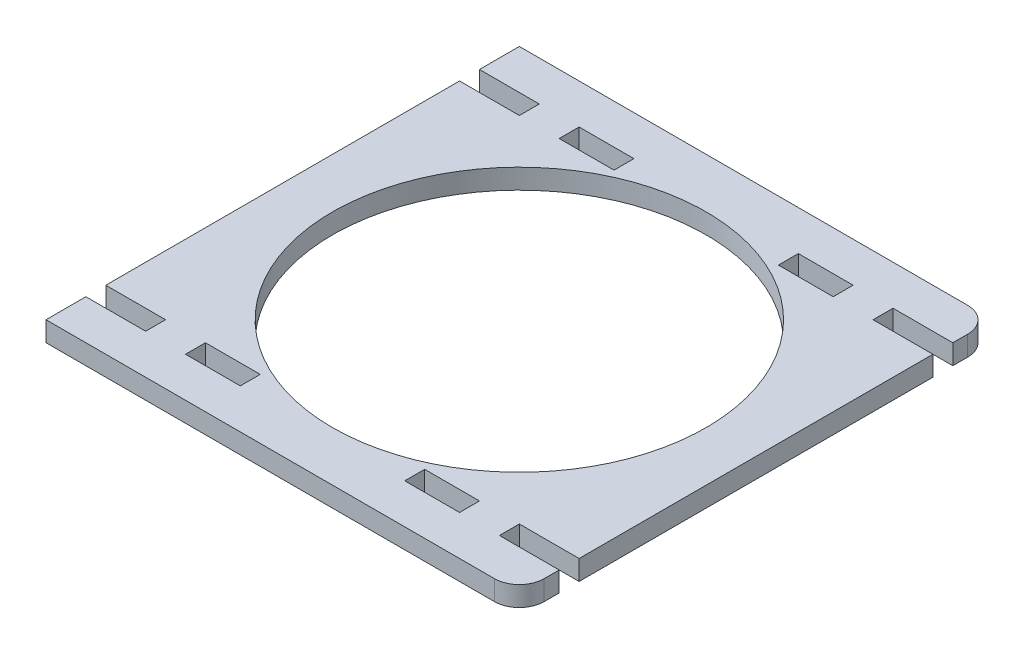
from build123d import *

# Parameters (mm, degrees)
SKETCH1_W           = 95
SKETCH1_H           = 95
SKETCH1_R           = 37.5
BOSS_EXTRUDE1_DEPTH = 2
SKETCH3_W           = 12
SKETCH3_H           = 4
SKETCH3_W_2         = 11
CUT_EXTRUDE5_DEPTH  = 68.294130502
FILLET1_R           = 5


with BuildPart() as part:
    # Sketch1 → Boss-Extrude1 (new, symmetric)
    with BuildSketch(Plane(origin=(0, 0, 0), x_dir=(1, 0, 0), z_dir=(0, 1, 0))):
        Rectangle(SKETCH1_W, SKETCH1_H)
        Circle(SKETCH1_R, mode=Mode.SUBTRACT)
    extrude(amount=BOSS_EXTRUDE1_DEPTH, both=True)

    # Sketch3 → Cut-Extrude5 (cut, through all)
    with BuildSketch(Plane(origin=(0, 2, 0), x_dir=(1, 0, 0), z_dir=(0, 1, 0))):
        with Locations((-41.5, -37.5)):
            Rectangle(SKETCH3_W, SKETCH3_H)
        with Locations((-41.5, 37.5)):
            Rectangle(SKETCH3_W, SKETCH3_H)
        with Locations((22, 37.5)):
            Rectangle(SKETCH3_W_2, SKETCH3_H)
        with Locations((41.5, -37.5)):
            Rectangle(SKETCH3_W, SKETCH3_H)
        with Locations((41.5, 37.5)):
            Rectangle(SKETCH3_W, SKETCH3_H)
        with Locations((22, -37.5)):
            Rectangle(SKETCH3_W_2, SKETCH3_H)
        with Locations((-22, -37.5)):
            Rectangle(SKETCH3_W_2, SKETCH3_H)
        with Locations((-22, 37.5)):
            Rectangle(SKETCH3_W_2, SKETCH3_H)
    extrude(amount=-CUT_EXTRUDE5_DEPTH, mode=Mode.SUBTRACT)

    # Fillet1
    fillet1_edges = [part.edges().sort_by_distance(p)[0] for p in [
        (47.5, 0, -47.5),
        (47.5, 0, 47.5),
    ]]
    fillet(fillet1_edges, radius=FILLET1_R)


solid = part.part
